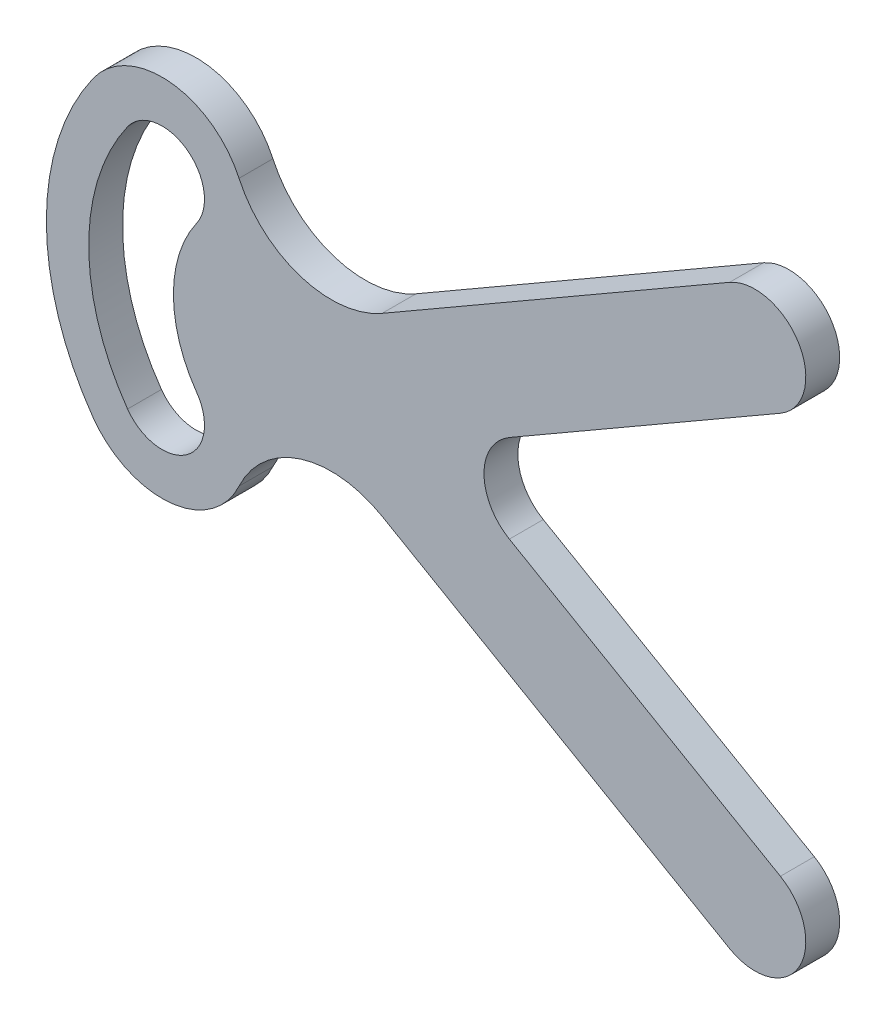
from build123d import *

# Parameters (mm, degrees)
SALIENTE_EXTRUIR2_DEPTH = 10


with BuildPart() as part:
    # Croquis1 → Saliente-Extruir2 (new body)
    with BuildSketch(Plane.XY):
        with BuildLine():
            Line((117.5, 85.159164705), (14.934164903, 25.942752202))
            ThreePointArc((14.934164903, 25.942752202), (-9.140901633, 23.329053884), (-27.302652317, 39.347513849))
            ThreePointArc((-27.302652317, 39.347513849), (-47.71673979, 53.763029578), (-70.412414523, 43.301270189))
            ThreePointArc((-70.412414523, 43.301270189), (-84.175170954, 0), (-70.412414523, -43.301270189))
            ThreePointArc((-70.412414523, -43.301270189), (-47.71673979, -53.763029578), (-27.302652317, -39.347513849))
            ThreePointArc((-27.302652317, -39.347513849), (-9.140901633, -23.329053884), (14.934164903, -25.942752202))
            Line((14.934164903, -25.942752202), (117.5, -85.159164705))
            ThreePointArc((117.5, -85.159164705), (137.990381057, -79.668783649), (132.5, -59.178402592))
            Line((132.5, -59.178402592), (52.5, -12.990381057))
            ThreePointArc((52.5, -12.990381057), (45, 0), (52.5, 12.990381057))
            Line((52.5, 12.990381057), (132.5, 59.178402592))
            ThreePointArc((132.5, 59.178402592), (137.990381057, 79.668783649), (117.5, 85.159164705))
        make_face()
        with BuildLine():
            ThreePointArc((-60.206207262, 36.084391824), (-71.675170954, 0), (-60.206207262, -36.084391824))
            ThreePointArc((-60.206207262, -36.084391824), (-42.783121635, -39.073720721), (-39.793792738, -21.650635095))
            ThreePointArc((-39.793792738, -21.650635095), (-46.675170954, 0), (-39.793792738, 21.650635095))
            ThreePointArc((-39.793792738, 21.650635095), (-42.783121635, 39.073720721), (-60.206207262, 36.084391824))
        make_face(mode=Mode.SUBTRACT)
    extrude(amount=SALIENTE_EXTRUIR2_DEPTH)


solid = part.part
